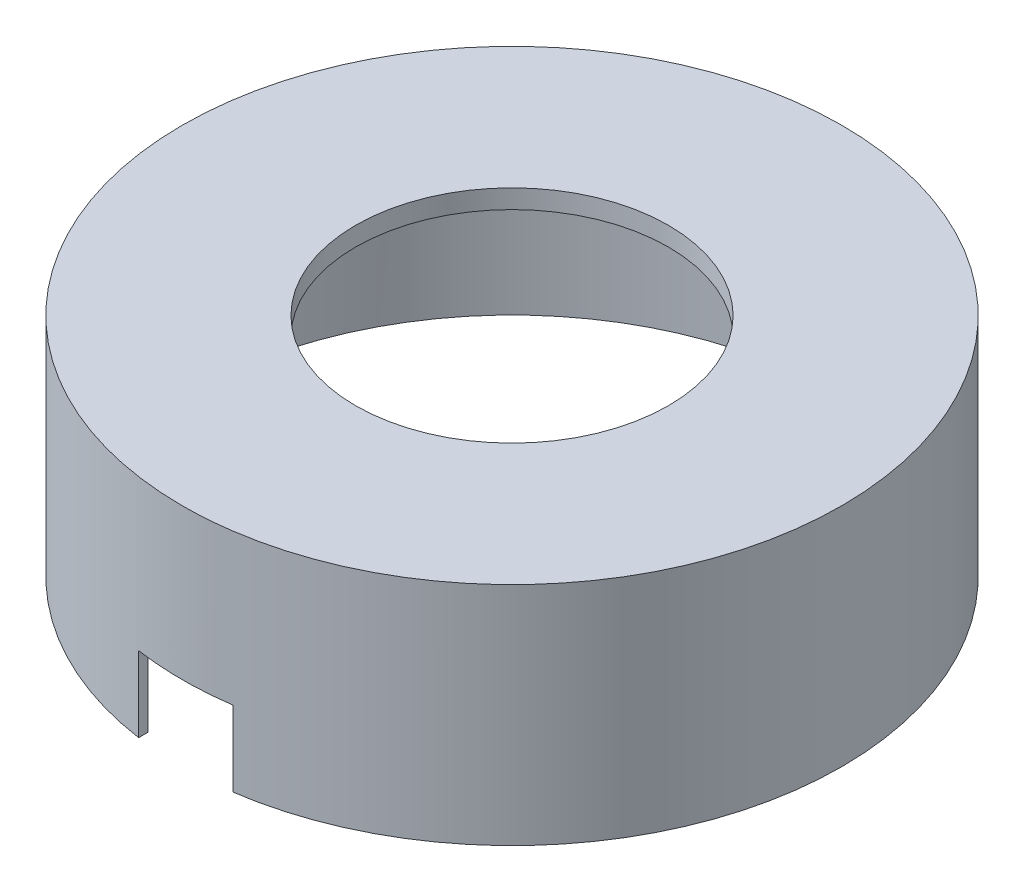
from build123d import *

# Parameters (mm, degrees)
SKETCH1_R               = 87.5
BOSS_EXTRUDE1_DEPTH     = 60
SKETCH2_R               = 85
CUT_EXTRUDE1_DEPTH      = 55
CUT_EXTRUDE2_REACH      = 137.416
SKETCH3_R               = 41.5
CUT_EXTRUDE3_REACH      = 206.649
CUT_EXTRUDE3_END_RADIUS = 85
SKETCH4_W               = 25
SKETCH4_H               = 20
CUT_EXTRUDE5_REACH      = 206.649
CUT_EXTRUDE5_END_RADIUS = 85
SKETCH5_W               = 6.2
SKETCH5_H               = 6.2
SKETCH5_H_2             = 6.393620859


with BuildPart() as part:
    # Sketch1 → Boss-Extrude1 (new body)
    with BuildSketch(Plane(origin=(0, 0, 0), x_dir=(1, 0, 0), z_dir=(0, 1, 0))):
        with Locations(Location((0, 0, 0), (0, 0, 270))):
            Circle(SKETCH1_R)
    extrude(amount=BOSS_EXTRUDE1_DEPTH)

    # Sketch2 → Cut-Extrude1 (cut)
    with BuildSketch(Plane.XZ):
        with Locations(Location((0, 0, 0), (0, 0, 270))):
            Circle(SKETCH2_R)
    extrude(amount=-CUT_EXTRUDE1_DEPTH, mode=Mode.SUBTRACT)

    # Sketch3 → Cut-Extrude2 (cut, up to next)
    with BuildSketch(Plane.XZ.offset(-55), mode=Mode.PRIVATE) as cut_extrude2_sk1:
        with Locations(Location((0, 0, 0), (0, 0, 270))):
            Circle(SKETCH3_R)
    cut_extrude2_tool1 = extrude(cut_extrude2_sk1.sketch, amount=-CUT_EXTRUDE2_REACH, mode=Mode.PRIVATE) & part.part
    add(cut_extrude2_tool1.solids().sort_by_distance((0, 55, 0))[0], mode=Mode.SUBTRACT)

    # Cut-Extrude3: up to this cylinder (the profile starts outside it)
    cut_extrude3_end = Plane(origin=(0, 10, 0), z_dir=(0, -1, 0)) * Cylinder(CUT_EXTRUDE3_END_RADIUS, 584.298, mode=Mode.PRIVATE)
    # Sketch4 → Cut-Extrude3 (cut, up to the surface)
    with BuildSketch(Plane.XY.offset(87.5), mode=Mode.PRIVATE) as cut_extrude3_sk1:
        with Locations((0, 10)):
            Rectangle(SKETCH4_W, SKETCH4_H)
    cut_extrude3_tool1 = extrude(cut_extrude3_sk1.sketch, amount=-CUT_EXTRUDE3_REACH, mode=Mode.PRIVATE) - cut_extrude3_end
    add(cut_extrude3_tool1.solids().sort_by_distance((0, 10, 87.5))[0], mode=Mode.SUBTRACT)

    # Cut-Extrude5: up to this cylinder (the profile starts outside it)
    cut_extrude5_end = Plane(origin=(0, 43.356907, 0), z_dir=(0, -1, 0)) * Cylinder(CUT_EXTRUDE5_END_RADIUS, 584.39481, mode=Mode.PRIVATE)
    # Sketch5 → Cut-Extrude5 (cut, up to the surface)
    with BuildSketch(Plane.XY.offset(-87.5), mode=Mode.PRIVATE) as cut_extrude5_sk1:
        with Locations((10, 43.405312256)):
            Rectangle(SKETCH5_W, SKETCH5_H)
    cut_extrude5_tool1 = extrude(cut_extrude5_sk1.sketch, amount=CUT_EXTRUDE5_REACH, mode=Mode.PRIVATE) - cut_extrude5_end
    add(cut_extrude5_tool1.solids().sort_by_distance((10, 43.405312, -87.5))[0], mode=Mode.SUBTRACT)
    # Sketch5 → Cut-Extrude5 (cut, up to the surface)
    with BuildSketch(Plane.XY.offset(-87.5), mode=Mode.PRIVATE) as cut_extrude5_sk2:
        with Locations((-10, 43.308501827)):
            Rectangle(SKETCH5_W, SKETCH5_H_2)
    cut_extrude5_tool2 = extrude(cut_extrude5_sk2.sketch, amount=CUT_EXTRUDE5_REACH, mode=Mode.PRIVATE) - cut_extrude5_end
    add(cut_extrude5_tool2.solids().sort_by_distance((-10, 43.308502, -87.5))[0], mode=Mode.SUBTRACT)


solid = part.part
